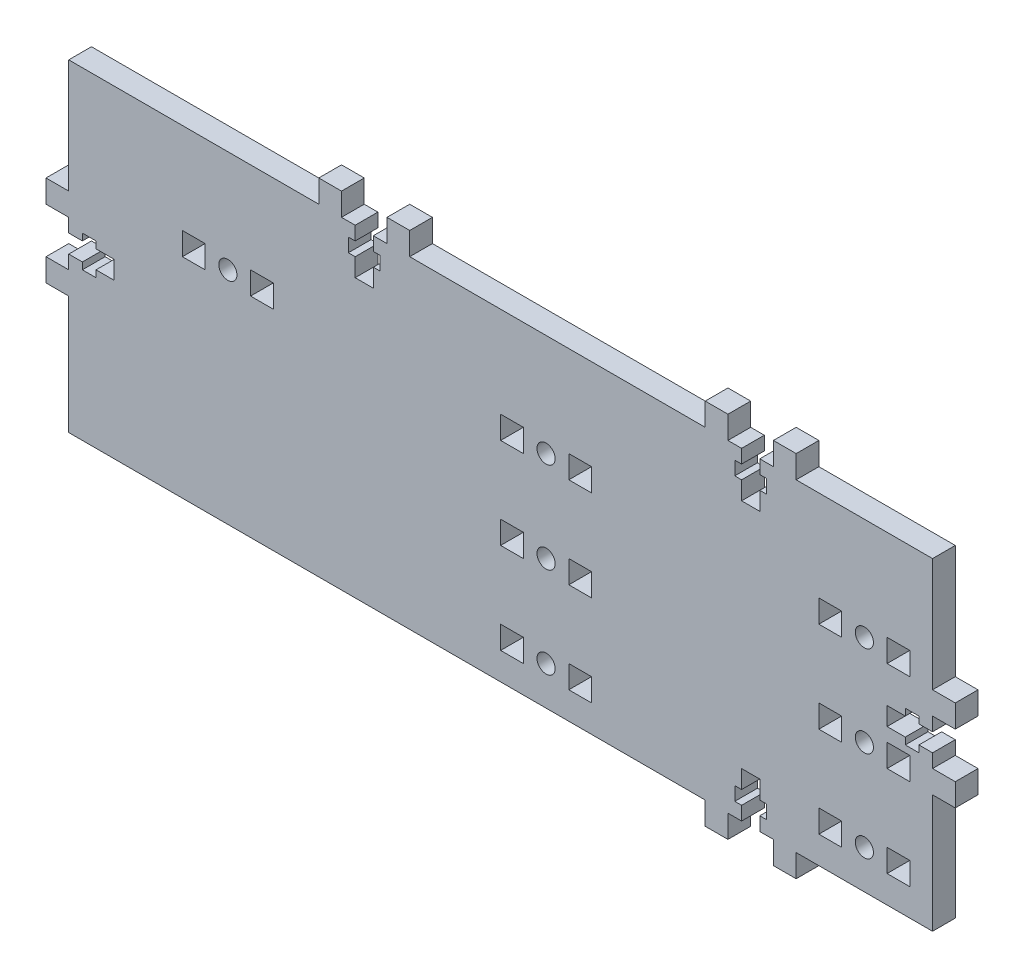
from build123d import *

# Parameters (mm, degrees)
ESQUISSE1_R        = 2
ESQUISSE1_W        = 5
ESQUISSE1_H        = 5
BOSS_EXTRU_1_DEPTH = 5


with BuildPart() as part:
    # Esquisse1 → Boss.-Extru.1 (new body)
    with BuildSketch(Plane.XY):
        Polygon((-105, 22.5), (-50, 22.5), (-50, 27.5), (-45, 27.5), (-45, 22.5), (-42, 22.5), (-42, 19.5), (-43.5, 19.5), (-43.5, 16.5), (-42, 16.5), (-42, 12.5), (-38, 12.5), (-38, 16.5), (-36.5, 16.5), (-36.5, 19.5), (-38, 19.5), (-38, 22.5), (-35, 22.5), (-35, 27.5), (-30, 27.5), (-30, 22.5), (35, 22.5), (35, 27.5), (40, 27.5), (40, 22.5), (43, 22.5), (43, 19.5), (41.5, 19.5), (41.5, 16.5), (43, 16.5), (43, 12.5), (47, 12.5), (47, 16.5), (48.5, 16.5), (48.5, 19.5), (47, 19.5), (47, 22.5), (50, 22.5), (50, 27.5), (55, 27.5), (55, 22.5), (85, 22.5), (85, -2.5), (90, -2.5), (90, -7.5), (85, -7.5), (85, -10.5), (82, -10.5), (82, -9), (79, -9), (79, -10.5), (75, -10.5), (75, -14.5), (79, -14.5), (79, -16), (82, -16), (82, -14.5), (85, -14.5), (85, -17.5), (90, -17.5), (90, -22.5), (85, -22.5), (85, -48.5), (55, -48.5), (55, -53.5), (50, -53.5), (50, -48.5), (47, -48.5), (47, -45.5), (48.5, -45.5), (48.5, -42.5), (47, -42.5), (47, -38.5), (43, -38.5), (43, -42.5), (41.5, -42.5), (41.5, -45.5), (43, -45.5), (43, -48.5), (40, -48.5), (40, -53.5), (35, -53.5), (35, -48.5), (-105, -48.5), (-105, -22.5), (-110, -22.5), (-110, -17.5), (-105, -17.5), (-105, -14.5), (-102, -14.5), (-102, -16), (-99, -16), (-99, -14.5), (-95, -14.5), (-95, -10.5), (-99, -10.5), (-99, -9), (-102, -9), (-102, -10.5), (-105, -10.5), (-105, -7.5), (-110, -7.5), (-110, -2.5), (-105, -2.5), align=None)
        Circle(ESQUISSE1_R, mode=Mode.SUBTRACT)
        with Locations((70, 0)):
            Circle(ESQUISSE1_R, mode=Mode.SUBTRACT)
        with Locations((0, -20)):
            Circle(ESQUISSE1_R, mode=Mode.SUBTRACT)
        with Locations((70, -20)):
            Circle(ESQUISSE1_R, mode=Mode.SUBTRACT)
        with Locations((0, -40)):
            Circle(ESQUISSE1_R, mode=Mode.SUBTRACT)
        with Locations((70, -40)):
            Circle(ESQUISSE1_R, mode=Mode.SUBTRACT)
        with Locations((-70, 0)):
            Circle(ESQUISSE1_R, mode=Mode.SUBTRACT)
        with Locations((-7.5, 0)):
            Rectangle(ESQUISSE1_W, ESQUISSE1_H, mode=Mode.SUBTRACT)
        with Locations((7.5, 0)):
            Rectangle(ESQUISSE1_W, ESQUISSE1_H, mode=Mode.SUBTRACT)
        with Locations((62.5, 0)):
            Rectangle(ESQUISSE1_W, ESQUISSE1_H, mode=Mode.SUBTRACT)
        with Locations((77.5, 0)):
            Rectangle(ESQUISSE1_W, ESQUISSE1_H, mode=Mode.SUBTRACT)
        with Locations((-7.5, -20)):
            Rectangle(ESQUISSE1_W, ESQUISSE1_H, mode=Mode.SUBTRACT)
        with Locations((7.5, -20)):
            Rectangle(ESQUISSE1_W, ESQUISSE1_H, mode=Mode.SUBTRACT)
        with Locations((62.5, -20)):
            Rectangle(ESQUISSE1_W, ESQUISSE1_H, mode=Mode.SUBTRACT)
        with Locations((77.5, -20)):
            Rectangle(ESQUISSE1_W, ESQUISSE1_H, mode=Mode.SUBTRACT)
        with Locations((-7.5, -40)):
            Rectangle(ESQUISSE1_W, ESQUISSE1_H, mode=Mode.SUBTRACT)
        with Locations((7.5, -40)):
            Rectangle(ESQUISSE1_W, ESQUISSE1_H, mode=Mode.SUBTRACT)
        with Locations((62.5, -40)):
            Rectangle(ESQUISSE1_W, ESQUISSE1_H, mode=Mode.SUBTRACT)
        with Locations((77.5, -40)):
            Rectangle(ESQUISSE1_W, ESQUISSE1_H, mode=Mode.SUBTRACT)
        with Locations((-77.5, 0)):
            Rectangle(ESQUISSE1_W, ESQUISSE1_H, mode=Mode.SUBTRACT)
        with Locations((-62.5, 0)):
            Rectangle(ESQUISSE1_W, ESQUISSE1_H, mode=Mode.SUBTRACT)
    extrude(amount=BOSS_EXTRU_1_DEPTH)


solid = part.part
